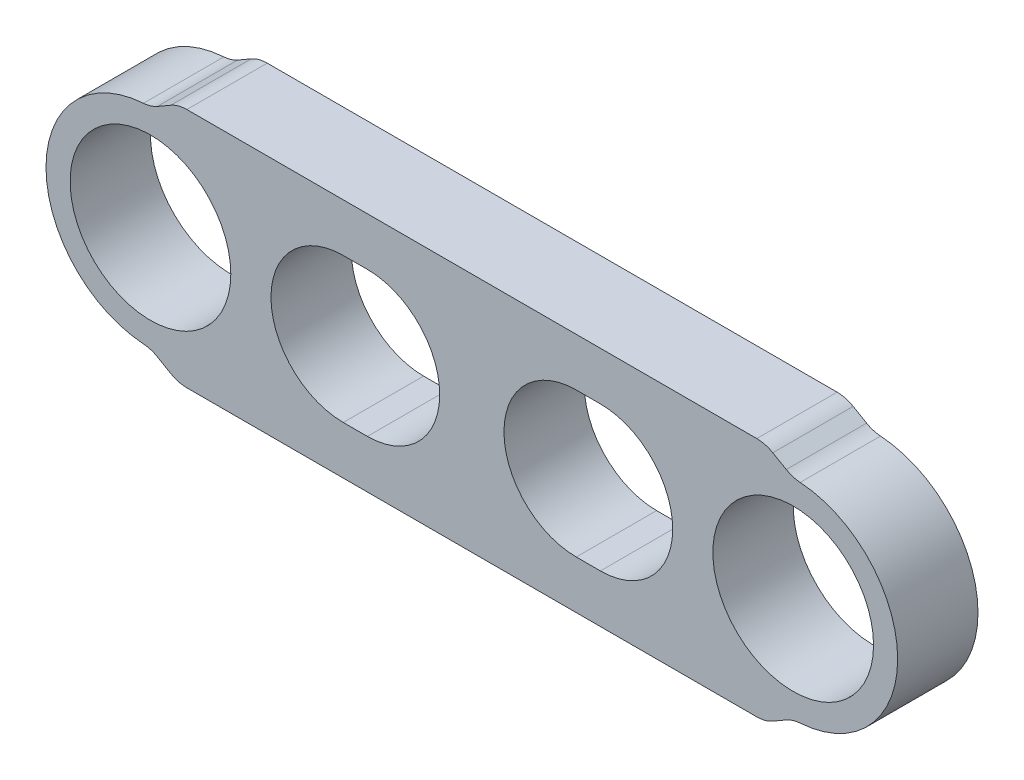
from build123d import *

# Parameters (mm, degrees)
SKETCH_1_R          = 3.5
EXTRUDE_1_DEPTH     = 5
CUT_EXTRUDE_2_DEPTH = 49.347699015
SKETCH_6_R          = 5
CUT_EXTRUDE_3_DEPTH = 6
CUT_EXTRUDE_4_DEPTH = 10
FILLET_1_R          = 2


with BuildPart() as part:
    # 草图1 → 凸台-拉伸1 (new body)
    with BuildSketch(Plane.XY):
        with BuildLine():
            Line((0, 7.5), (40, 7.5))
            ThreePointArc((40, 7.5), (47.5, 0), (40, -7.5))
            Line((40, -7.5), (0, -7.5))
            ThreePointArc((0, -7.5), (-7.5, 0), (0, 7.5))
        make_face()
        Circle(SKETCH_1_R, mode=Mode.SUBTRACT)
        with Locations((40, 0)):
            Circle(SKETCH_1_R, mode=Mode.SUBTRACT)
    extrude(amount=EXTRUDE_1_DEPTH)

    # 草图3 → 切除-拉伸2 (cut, through all)
    with BuildSketch(Plane.XY.offset(5)):
        with BuildLine():
            ThreePointArc((0, -6.5), (-6.5, 0), (0, 6.5))
            Line((0, 6.5), (1.732050808, 7.5))
            Line((1.732050808, 7.5), (0, 7.5))
            ThreePointArc((0, 7.5), (-7.5, 0), (0, -7.5))
            Line((0, -7.5), (1.732050808, -7.5))
            Line((1.732050808, -7.5), (0, -6.5))
        make_face()
        with BuildLine():
            Line((40, 7.5), (38.267949192, 7.5))
            Line((38.267949192, 7.5), (40, 6.5))
            ThreePointArc((40, 6.5), (44.596194078, 4.596194078), (46.5, 0))
            ThreePointArc((46.5, 0), (44.596194078, -4.596194078), (40, -6.5))
            Line((40, -6.5), (38.267949192, -7.5))
            Line((38.267949192, -7.5), (40, -7.5))
            ThreePointArc((40, -7.5), (47.5, 0), (40, 7.5))
        make_face()
    extrude(amount=-CUT_EXTRUDE_2_DEPTH, mode=Mode.SUBTRACT)

    # 草图6 → 切除-拉伸3 (cut)
    with BuildSketch(Plane.XY.offset(5)):
        Circle(SKETCH_6_R)
        with Locations((40, 0)):
            Circle(SKETCH_6_R)
    extrude(amount=-CUT_EXTRUDE_3_DEPTH, mode=Mode.SUBTRACT)

    # 草图4 → 切除-拉伸4 (cut)
    with BuildSketch(Plane.XY.offset(5)):
        with BuildLine():
            Line((12, 4.5), (13.5, 4.5))
            ThreePointArc((13.5, 4.5), (18, 0), (13.5, -4.5))
            Line((13.5, -4.5), (12, -4.5))
            ThreePointArc((12, -4.5), (7.5, 0), (12, 4.5))
        make_face()
        with BuildLine():
            Line((28, 4.5), (26.5, 4.5))
            ThreePointArc((26.5, 4.5), (22, 0), (26.5, -4.5))
            Line((26.5, -4.5), (28, -4.5))
            ThreePointArc((28, -4.5), (32.5, 0), (28, 4.5))
        make_face()
    extrude(amount=-CUT_EXTRUDE_4_DEPTH, mode=Mode.SUBTRACT)

    # 圆角1
    fillet_1_edges = [part.edges().sort_by_distance(p)[0] for p in [
        (0, 6.5, 2.5),
        (0, -6.5, 2.5),
        (1.732050808, -7.5, 2.5),
        (1.732050808, 7.5, 2.5),
        (40, 6.5, 2.5),
        (38.267949192, 7.5, 2.5),
        (38.267949192, -7.5, 2.5),
        (40, -6.5, 2.5),
    ]]
    fillet(fillet_1_edges, radius=FILLET_1_R)


solid = part.part
